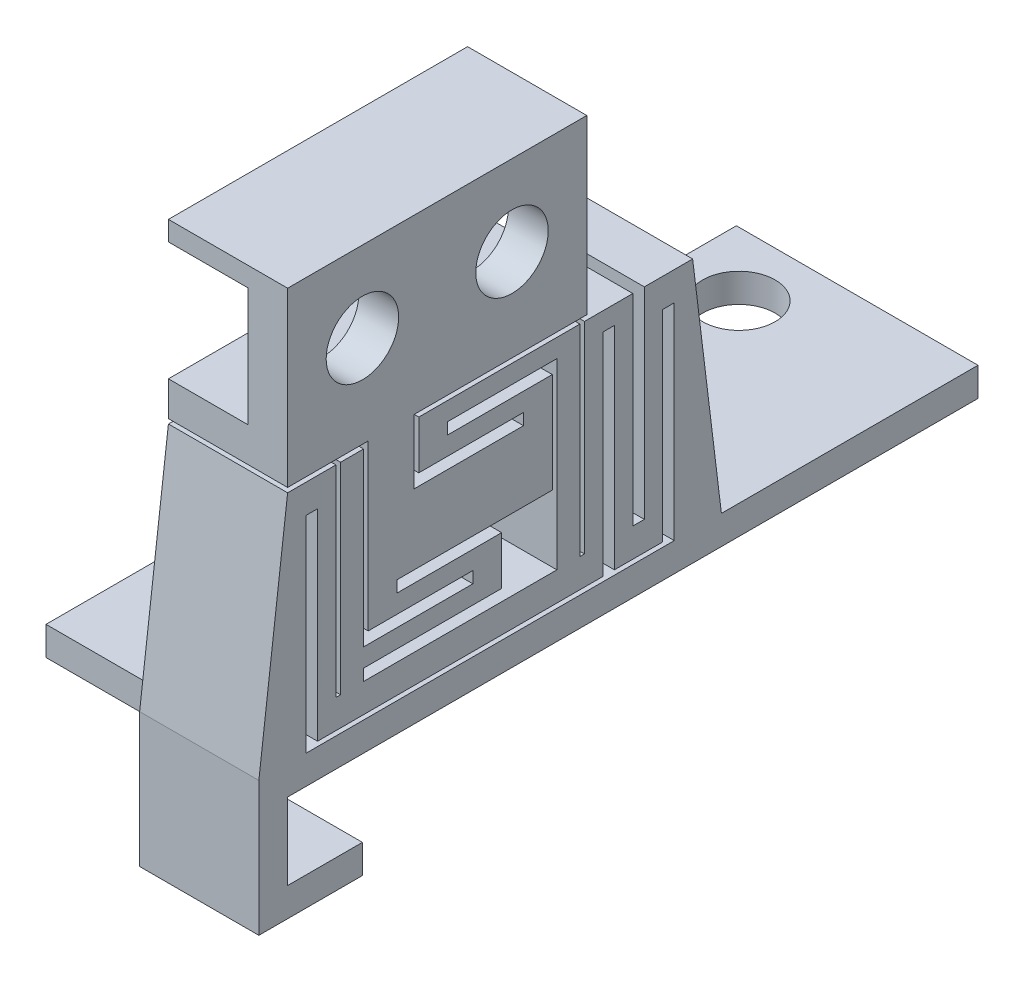
from build123d import *

# Parameters (mm, degrees)
BOSS_EXTRUDE1_DEPTH = 5.18
CUT_EXTRUDE1_REACH  = 32.745
SKETCH2_W           = 3.45
SKETCH2_H           = 5.15
SKETCH3_W           = 10.5
SKETCH3_H           = 30
SKETCH3_R           = 1.575
BOSS_EXTRUDE2_DEPTH = 1.25
CUT_EXTRUDE3_REACH  = 41.666
SKETCH7_R           = 1.575


with BuildPart() as part:
    # Sketch1 → Boss-Extrude1 (new body)
    with BuildSketch(Plane(origin=(0, 0, 0), x_dir=(0, 0, -1), z_dir=(1, 0, 0))):
        Polygon((0, 0), (13, 0), (13, -7.5), (5.5, -7.5), (5.5, -10.3), (10.25, -10.3), (10.25, -9.8), (5.7, -9.8), (5.7, -7.7), (12.7, -7.7), (12.7, -16.45), (12.9, -16.45), (12.9, -7.7), (15, -7.7), (15, -16.45), (15.5, -16.45), (15.5, -7.7), (17.6, -7.7), (18.85, -17.9), (18.85, -19.15), (0, -19.15), (0, -22.48), (3.25, -22.48), (3.25, -23.73), (-1.25, -23.73), (-1.25, -17.9), (0, -7.7), (2.1, -7.7), (2.1, -16.45), (2.3, -16.45), (2.3, -7.7), (3.3, -7.7), (3.3, -15.15), (8.05, -15.15), (8.05, -14.65), (3.5, -14.65), (3.5, -7.5), (0, -7.5), align=None)
        Polygon((13.7, -8.5), (13.7, -17.7), (1.3, -17.7), (1.3, -8.95), (0.8, -8.95), (0.8, -17.9), (16.8, -17.9), (16.8, -8.95), (16.3, -8.95), (16.3, -17.7), (14.2, -17.7), (14.2, -8.5), align=None, mode=Mode.SUBTRACT)
        Polygon((3.3, -16.45), (11.7, -16.45), (11.7, -8.5), (6.95, -8.5), (6.95, -9), (11.5, -9), (11.5, -13.35), (4.75, -13.35), (4.75, -13.85), (9.3, -13.85), (9.3, -15.95), (3.3, -15.95), align=None, mode=Mode.SUBTRACT)
    extrude(amount=BOSS_EXTRUDE1_DEPTH)

    # Sketch2 → Cut-Extrude1 (cut, up to next)
    with BuildSketch(Plane.XY, mode=Mode.PRIVATE) as cut_extrude1_sk1:
        with Locations((3.455, -3.425)):
            Rectangle(SKETCH2_W, SKETCH2_H)
    cut_extrude1_tool1 = extrude(cut_extrude1_sk1.sketch, amount=-CUT_EXTRUDE1_REACH, mode=Mode.PRIVATE) & part.part
    add(cut_extrude1_tool1.solids().sort_by_distance((3.455, -3.425, 0))[0], mode=Mode.SUBTRACT)

    # Sketch3 → Boss-Extrude2 (add)
    with BuildSketch(Plane.XZ.offset(19.15)):
        with Locations((5.25, -15)):
            Rectangle(SKETCH3_W, SKETCH3_H)
        with Locations(Location((7.62, -15.23, 0), (0, 0, 270))):
            Circle(SKETCH3_R, mode=Mode.SUBTRACT)
        with Locations(Location((7.62, -27.23, 0), (0, 0, 270))):
            Circle(SKETCH3_R, mode=Mode.SUBTRACT)
    extrude(amount=-BOSS_EXTRUDE2_DEPTH)

    # Sketch7 → Cut-Extrude3 (cut, up to next)
    with BuildSketch(Plane.ZY, mode=Mode.PRIVATE) as cut_extrude3_sk1:
        with Locations((-3.25, -3.5)):
            Circle(SKETCH7_R)
    cut_extrude3_tool1 = extrude(cut_extrude3_sk1.sketch, amount=-CUT_EXTRUDE3_REACH, mode=Mode.PRIVATE) & part.part
    # Sketch7 → Cut-Extrude3 (cut, up to next)
    with BuildSketch(Plane.ZY, mode=Mode.PRIVATE) as cut_extrude3_sk2:
        with Locations((-9.75, -3.5)):
            Circle(SKETCH7_R)
    cut_extrude3_tool2 = extrude(cut_extrude3_sk2.sketch, amount=-CUT_EXTRUDE3_REACH, mode=Mode.PRIVATE) & part.part
    add(cut_extrude3_tool1.solids().sort_by_distance((0, -3.5, -3.25))[0], mode=Mode.SUBTRACT)
    add(cut_extrude3_tool2.solids().sort_by_distance((0, -3.5, -9.75))[0], mode=Mode.SUBTRACT)


with BuildPart() as body_2:
    # Mirror3: mirrored copy
    add(part.part.mirror(Plane(origin=(0, 0, 0), x_dir=(0, 0, 1), z_dir=(1, 0, 0))))


solid = body_2.part
